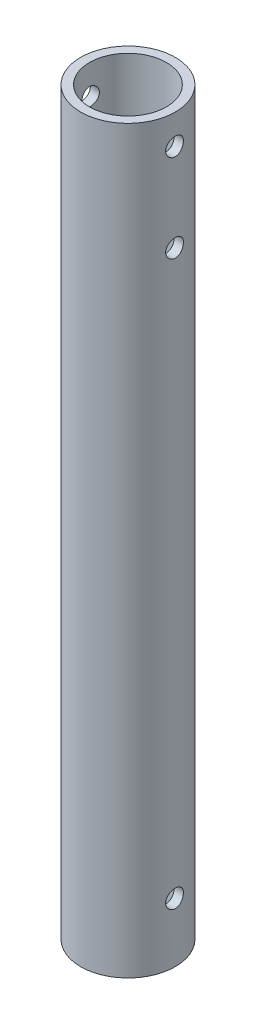
from build123d import *

# Parameters (mm, degrees)
SKETCH_1_R          = 8
SKETCH_1_R_2        = 6.5
EXTRUDE_1_DEPTH     = 125
SKETCH_3_R          = 1.5
CUT_EXTRUDE_2_DEPTH = 62.5


with BuildPart() as part:
    # 草图1 → 凸台-拉伸1 (new body)
    with BuildSketch(Plane(origin=(0, 0, 0), x_dir=(1, 0, 0), z_dir=(0, 1, 0))):
        with Locations(Location((0, 0, 0), (0, 0, 270))):
            Circle(SKETCH_1_R)
        with Locations(Location((0, 0, 0), (0, 0, 270))):
            Circle(SKETCH_1_R_2, mode=Mode.SUBTRACT)
    extrude(amount=EXTRUDE_1_DEPTH)

    # 草图3 → 切除-拉伸2 (cut, symmetric)
    with BuildSketch(Plane(origin=(0, 0, 0), x_dir=(0, 0, -1), z_dir=(1, 0, 0))):
        with Locations((0, 119.968615881)):
            Circle(SKETCH_3_R)
        with Locations((0, 105.132120497)):
            Circle(SKETCH_3_R)
        with Locations((0, 10)):
            Circle(SKETCH_3_R)
    extrude(amount=CUT_EXTRUDE_2_DEPTH, both=True, mode=Mode.SUBTRACT)


solid = part.part
